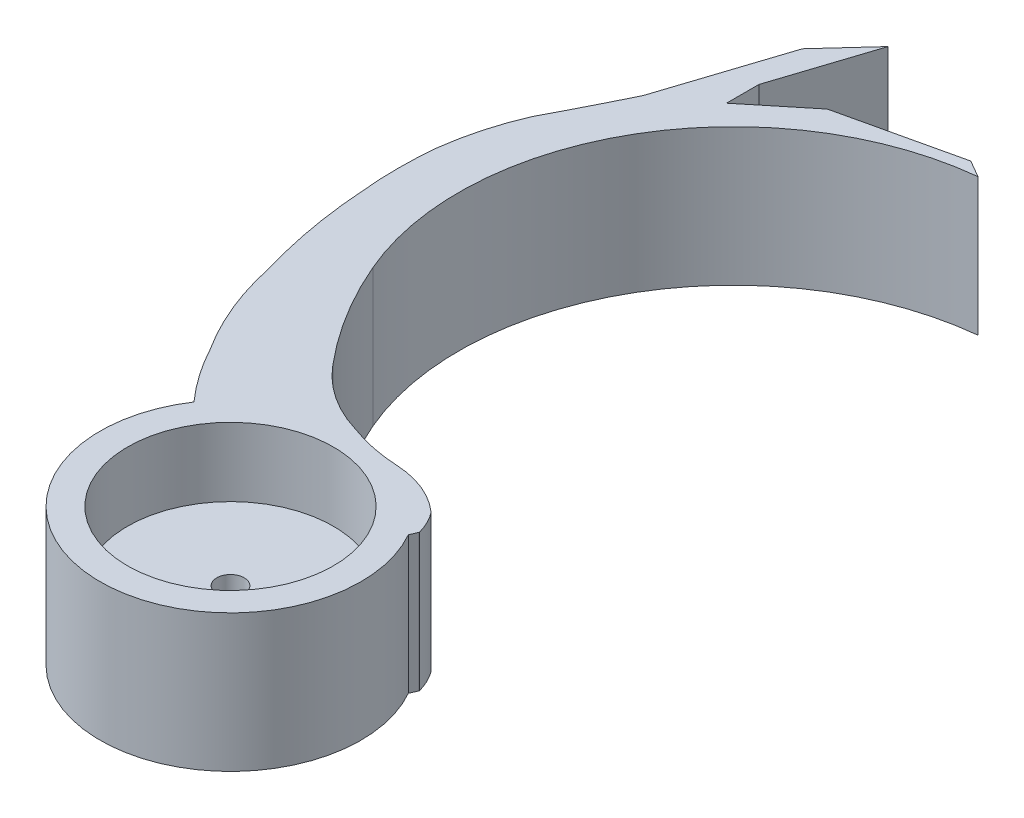
from build123d import *

# Parameters (mm, degrees)
SUNGU_KIRI_R        = 1
BOSS_EXTRUDE1_DEPTH = 10
SKETCH9_R           = 7.5
CUT_EXTRUDE5_DEPTH  = 5


with BuildPart() as part:
    # sungu kiri → Boss-Extrude1 (new body)
    with BuildSketch(Plane(origin=(0, 0, 0), x_dir=(1, 0, 0), z_dir=(0, 1, 0))):
        with BuildLine():
            Line((-20.214241335, 18.58200887), (-17.903708636, 25.676772527))
            Line((-17.903708636, 25.676772527), (-20.879327355, 22.419581076))
            Line((-20.879327355, 22.419581076), (-23.726014444, 13.678492013))
            ThreePointArc((-23.726014444, 13.678492013), (-25.061399851, 10.98195956), (-26.444409257, 8.309539974))
            ThreePointArc((-26.444409257, 8.309539974), (-27.383764934, 5.63006722), (-27.936945566, 2.845115782))
            ThreePointArc((-27.936945566, 2.845115782), (-28.068014235, 0.18049064), (-27.936945566, -2.484134502))
            ThreePointArc((-27.936945566, -2.484134502), (-27.425713247, -6.715299694), (-26.444409257, -10.862727794))
            ThreePointArc((-26.444409257, -10.862727794), (-25.296755437, -14.61403578), (-23.488374839, -18.095297119))
            ThreePointArc((-23.488374839, -18.095297119), (-22.238356067, -20.131176806), (-20.758136978, -22.006357992))
            ThreePointArc((-20.758136978, -22.006357992), (-13.175246696, -36.755405871), (-4.582277955, -22.571064976))
            ThreePointArc((-4.582277955, -22.571064976), (-4.460378612, -22.299351604), (-4.344569641, -22.024987085))
            ThreePointArc((-4.344569641, -22.024987085), (-4.340995805, -22.01171692), (-4.3373846, -21.998456875))
            ThreePointArc((-4.3373846, -21.998456875), (-4.667057778, -21.129677391), (-5.155481579, -20.33916845))
            ThreePointArc((-5.155481579, -20.33916845), (-7.110923153, -19.117606911), (-9.361873626, -18.618421268))
            ThreePointArc((-9.361873626, -18.618421268), (-11.285784226, -18.376920372), (-13.150188878, -17.844238508))
            ThreePointArc((-13.150188878, -17.844238508), (-15.818147575, -16.60648921), (-18.010368345, -14.645827324))
            ThreePointArc((-18.010368345, -14.645827324), (-20.650416196, -11.005311906), (-22.72256926, -7.01414831))
            ThreePointArc((-22.72256926, -7.01414831), (-21.584958488, 10.98418111), (-6.423603233, 20.74980075))
            Line((-6.423603233, 20.74980075), (-7.667855794, 21.470443038))
            Line((-7.667855794, 21.470443038), (-16.17291449, 19.521519125))
            Line((-16.17291449, 19.521519125), (-20.214241335, 16.223172594))
            Line((-20.214241335, 16.223172594), (-20.214241335, 18.58200887))
        make_face()
        with Locations(Location((-12.843799059, -27.261189607, 0), (0, 0, 270))):
            Circle(SUNGU_KIRI_R, mode=Mode.SUBTRACT)
    extrude(amount=BOSS_EXTRUDE1_DEPTH)

    # Sketch9 → Cut-Extrude5 (cut)
    with BuildSketch(Plane(origin=(0, 10, 0), x_dir=(1, 0, 0), z_dir=(0, 1, 0))):
        with Locations(Location((-12.843799059, -27.261189607, 0), (0, 0, 270))):
            Circle(SKETCH9_R)
    extrude(amount=-CUT_EXTRUDE5_DEPTH, mode=Mode.SUBTRACT)


solid = part.part
